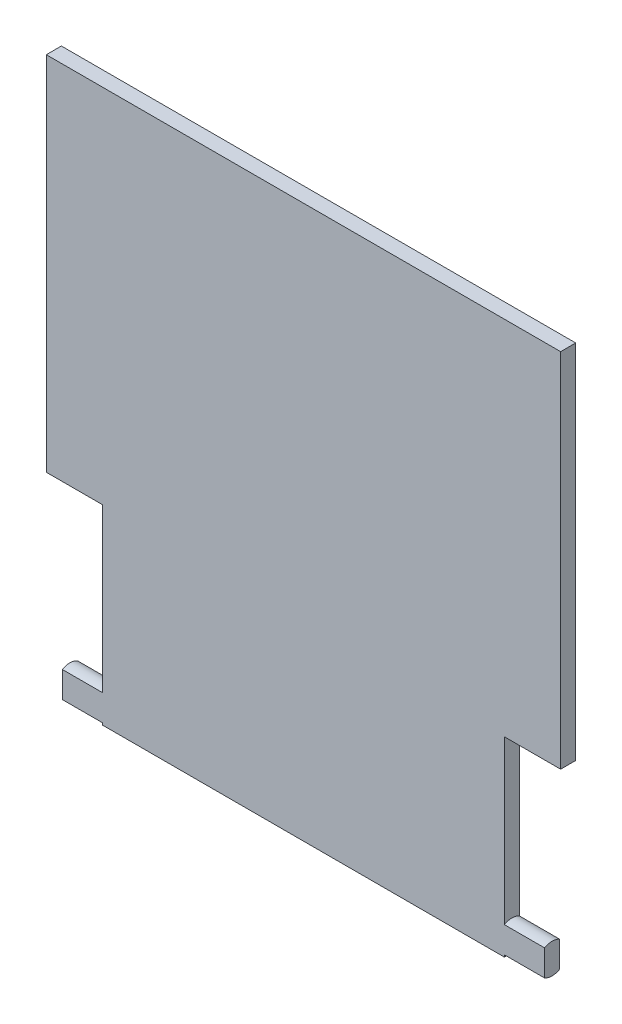
from build123d import *

# Parameters (mm, degrees)
BOSS_EXTRUDE1_DEPTH = 0.75
SKETCH2_R           = 1.584525309
SKETCH2_R_2         = 0.75
CUT_EXTRUDE1_DEPTH  = 2
CUT_EXTRUDE2_START  = -2
SKETCH3_R           = 1.564549905
SKETCH3_R_2         = 0.75
CUT_EXTRUDE2_DEPTH  = 2


with BuildPart() as part:
    # Sketch1 → Boss-Extrude1 (new body)
    with BuildSketch(Plane.XY):
        Polygon((12, 0), (-12, 0), (-12, 1.5), (-10, 1.5), (-10, 9.5), (-12.8, 9.5), (-12.8, 27.5), (12.8, 27.5), (12.8, 9.5), (10, 9.5), (10, 1.5), (12, 1.5), align=None)
    extrude(amount=BOSS_EXTRUDE1_DEPTH)

    # Sketch2 → Cut-Extrude1 (cut)
    with BuildSketch(Plane.ZY.offset(12)):
        with Locations((0.375, 0.75)):
            Circle(SKETCH2_R)
        with Locations((0.375, 0.75)):
            Circle(SKETCH2_R_2, mode=Mode.SUBTRACT)
    extrude(amount=-CUT_EXTRUDE1_DEPTH, mode=Mode.SUBTRACT)

    # Sketch3 → Cut-Extrude2 (cut)
    with BuildSketch(Plane(origin=(12, 0, 0), x_dir=(0, 0, -1), z_dir=(1, 0, 0)).offset(CUT_EXTRUDE2_START)):
        with Locations((-0.375, 0.75)):
            Circle(SKETCH3_R)
        with Locations((-0.375, 0.75)):
            Circle(SKETCH3_R_2, mode=Mode.SUBTRACT)
    extrude(amount=CUT_EXTRUDE2_DEPTH, mode=Mode.SUBTRACT)


solid = part.part
